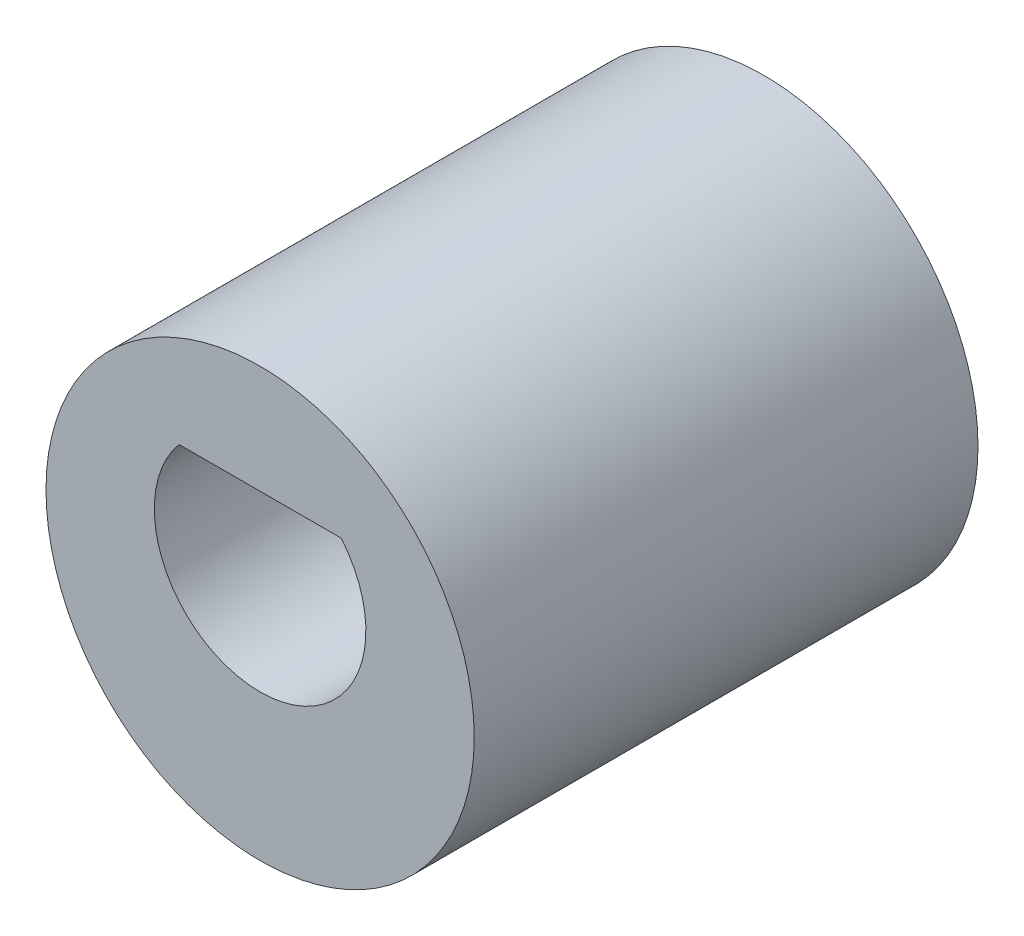
from build123d import *

# Parameters (mm, degrees)
SKETCH2_R           = 8.5
SKETCH2_R_2         = 0.5
BOSS_EXTRUDE1_DEPTH = 20
SKETCH3_R           = 0.5
SKETCH3_R_2         = 2.3
CUT_EXTRUDE1_DEPTH  = 6
CUT_EXTRUDE2_DEPTH  = 12


with BuildPart() as part:
    # Sketch2 → Boss-Extrude1 (new body)
    with BuildSketch(Plane.XY):
        Circle(SKETCH2_R)
        with Locations((0, 1.5)):
            Circle(SKETCH2_R_2, mode=Mode.SUBTRACT)
    extrude(amount=BOSS_EXTRUDE1_DEPTH)

    # Sketch3 → Cut-Extrude1 (cut)
    with BuildSketch(Plane.XY):
        with Locations((0, 1.5)):
            Circle(SKETCH3_R)
        with Locations((-5, 1.5)):
            Circle(SKETCH3_R_2)
        with Locations((5, 1.5)):
            Circle(SKETCH3_R_2)
    extrude(amount=CUT_EXTRUDE1_DEPTH, mode=Mode.SUBTRACT)

    # Sketch5 → Cut-Extrude2 (cut)
    with BuildSketch(Plane.XY.offset(20)):
        with BuildLine():
            Line((-3.217141588, 4.2), (3.217141588, 4.2))
            ThreePointArc((3.217141588, 4.2), (0, -2.7), (-3.217141588, 4.2))
        make_face()
    extrude(amount=-CUT_EXTRUDE2_DEPTH, mode=Mode.SUBTRACT)


solid = part.part
